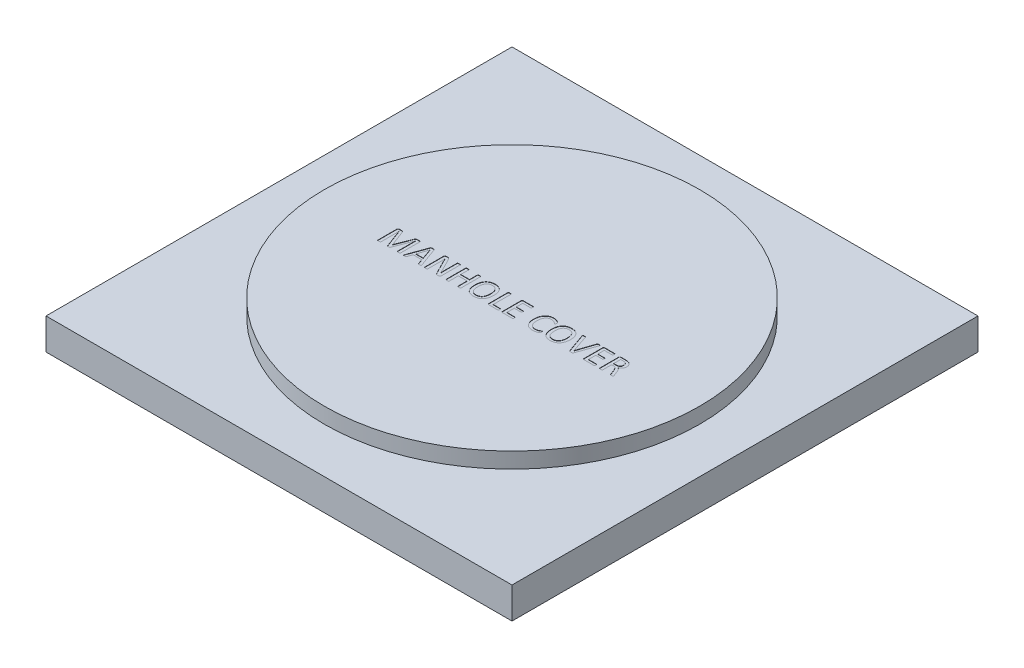
from build123d import *

# Parameters (mm, degrees)
SKETCH1_W           = 1490
SKETCH1_H           = 1490
BOSS_EXTRUDE1_DEPTH = 100
SKETCH2_R           = 600
BOSS_EXTRUDE2_DEPTH = 50
CUT_EXTRUDE1_DEPTH  = 1


with BuildPart() as part:
    # Sketch1 → Boss-Extrude1 (new body)
    with BuildSketch(Plane(origin=(0, 0, 0), x_dir=(1, 0, 0), z_dir=(0, 1, 0))):
        Rectangle(SKETCH1_W, SKETCH1_H)
    extrude(amount=BOSS_EXTRUDE1_DEPTH)

    # Sketch2 → Boss-Extrude2 (add)
    with BuildSketch(Plane(origin=(0, 100, 0), x_dir=(1, 0, 0), z_dir=(0, 1, 0))):
        with Locations(Location((0, 0, 0), (0, 0, 270))):
            Circle(SKETCH2_R)
    extrude(amount=BOSS_EXTRUDE2_DEPTH)

    # Sketch3 → Cut-Extrude1 (cut)
    # profile 1 of 12: a face of its own
    with BuildSketch(Plane(origin=(0, 150, 0), x_dir=(1, 0, 0), z_dir=(0, 1, 0))):
        with BuildLine():
            add(Edge.make_bspline(
                [(-302.519914216, -54.441295243), (-302.531290085, -54.570175678), (-302.553925876, -54.826622955), (-302.752547962, -55.182973018), (-303.101917063, -55.469457519), (-303.608901488, -55.674527482), (-304.280922797, -55.804356236), (-305.117146008, -55.974469731), (-306.186633031, -56.053795424), (-306.973189711, -56.062631324), (-307.413976333, -56.067582965)],
                knots=[0, 0, 0, 0, 0.549940415, 1.094275647, 1.695058239, 2.453752044, 3.41269449, 4.626954335, 6.109744105, 8, 8, 8, 8], degree=3))
            add(Edge.make_bspline(
                [(-307.413976333, -56.067582965), (-307.82938277, -56.061677257), (-308.600598927, -56.050713109), (-309.660357327, -55.975619013), (-310.511070149, -55.804582068), (-311.18609928, -55.678753901), (-311.681790371, -55.464299218), (-312.03309373, -55.18741814), (-312.209603042, -54.822164496), (-312.234575833, -54.569468748), (-312.247242647, -54.441295243)],
                knots=[0, 0, 0, 0, 1.798275377, 3.338559297, 4.58570577, 5.553580443, 6.299307474, 6.905686155, 7.444937074, 8, 8, 8, 8], degree=3))
            Line((-312.247242647, -54.441295243), (-312.247242647, 2.90434565))
            Line((-312.247242647, 2.90434565), (-312.353635302, 2.90434565))
            Line((-312.353635302, 2.90434565), (-334.513705384, -54.699677404))
            add(Edge.make_bspline(
                [(-334.513705384, -54.699677404), (-334.570010284, -54.809055366), (-334.685665759, -55.033727823), (-334.95261814, -55.322939973), (-335.310590085, -55.588288889), (-335.794562027, -55.767429388), (-336.388510164, -55.899365395), (-337.084178343, -56.005373448), (-337.90712003, -56.064326931), (-338.495729198, -56.066437908), (-338.815008425, -56.067582965)],
                knots=[0, 0, 0, 0, 0.617868315, 1.269158706, 1.964077171, 2.846421734, 3.844013633, 5.032644331, 6.390417486, 8, 8, 8, 8], degree=3))
            add(Edge.make_bspline(
                [(-338.815008425, -56.067582965), (-339.149372854, -56.059351628), (-339.768032747, -56.044121544), (-340.628292744, -55.995801121), (-341.345536508, -55.874713386), (-341.929468665, -55.714537904), (-342.385176661, -55.507444217), (-342.751223452, -55.293607048), (-342.986040276, -55.003149672), (-343.084452176, -54.797847867), (-343.131510417, -54.699677404)],
                knots=[0, 0, 0, 0, 1.684713544, 3.117151853, 4.33356902, 5.342914851, 6.153770431, 6.85436779, 7.4521858, 8, 8, 8, 8], degree=3))
            Line((-343.131510417, -54.699677404), (-364.714020374, 2.90434565))
            Line((-364.714020374, 2.90434565), (-364.774816176, 2.90434565))
            Line((-364.774816176, 2.90434565), (-364.774816176, -54.441295243))
            add(Edge.make_bspline(
                [(-364.774816176, -54.441295243), (-364.786192485, -54.570173794), (-364.808829151, -54.82661732), (-365.007444506, -55.18299625), (-365.356844254, -55.469349312), (-365.868295607, -55.676987664), (-366.551342097, -55.803276984), (-367.407448378, -55.975732586), (-368.492319185, -56.052510455), (-369.288916203, -56.06221399), (-369.729674096, -56.067582965)],
                knots=[0, 0, 0, 0, 0.544103173, 1.082660658, 1.677066352, 2.427707141, 3.397415481, 4.619936966, 6.129807882, 8, 8, 8, 8], degree=3))
            add(Edge.make_bspline(
                [(-369.729674096, -56.067582965), (-370.155191141, -56.061933514), (-370.931459632, -56.051627249), (-371.991557922, -55.976477629), (-372.831273372, -55.802178259), (-373.498008987, -55.681828117), (-373.983702339, -55.464501443), (-374.320787516, -55.185886403), (-374.479788284, -54.819642187), (-374.494591179, -54.569125602), (-374.502144608, -54.441295243)],
                knots=[0, 0, 0, 0, 1.8533371, 3.381033053, 4.614072809, 5.587846392, 6.318072483, 6.911573342, 7.444611737, 8, 8, 8, 8], degree=3))
            Line((-374.502144608, -54.441295243), (-374.502144608, 6.111324242))
            add(Edge.make_bspline(
                [(-374.502144608, 6.111324242), (-374.490370759, 6.442507557), (-374.468300977, 7.063302278), (-374.234465266, 7.915204379), (-373.87427258, 8.639866381), (-373.315754782, 9.168417274), (-372.697063771, 9.573095222), (-372.030826344, 9.872197012), (-371.328595393, 10.038492342), (-370.850126157, 10.065009579), (-370.611213235, 10.078250368)],
                knots=[0, 0, 0, 0, 1.261982118, 2.365553467, 3.35280749, 4.310975745, 5.26129003, 6.171318277, 7.086888644, 8, 8, 8, 8], degree=3))
            Line((-370.611213235, 10.078250368), (-364.896407782, 10.078250368))
            add(Edge.make_bspline(
                [(-364.896407782, 10.078250368), (-364.343148001, 10.066314818), (-363.312242519, 10.044074951), (-361.860446848, 9.813855927), (-360.592440866, 9.432504893), (-359.507154999, 8.835914721), (-358.567324094, 8.091237425), (-357.83396325, 7.117996084), (-357.203940992, 5.996160101), (-356.885844082, 5.163815924), (-356.719372319, 4.728219731)],
                knots=[0, 0, 0, 0, 1.24751318, 2.324528587, 3.308036964, 4.218670816, 5.104345063, 5.991788597, 6.949029422, 8, 8, 8, 8], degree=3))
            Line((-356.719372319, 4.728219731), (-338.511029412, -42.935689583))
            Line((-338.511029412, -42.935689583), (-338.25264725, -42.935689583))
            Line((-338.25264725, -42.935689583), (-319.740325329, 4.576230224))
            add(Edge.make_bspline(
                [(-319.740325329, 4.576230224), (-319.536918086, 5.051848067), (-319.154011803, 5.947180296), (-318.470892433, 7.147540737), (-317.722847116, 8.130395793), (-316.888582294, 8.892746582), (-315.966974578, 9.461820268), (-314.934674224, 9.823531463), (-313.781234653, 10.038709835), (-312.967713064, 10.064542447), (-312.53602271, 10.078250368)],
                knots=[0, 0, 0, 0, 1.266394147, 2.383938095, 3.374429421, 4.279357972, 5.137103734, 6.00865411, 6.943304242, 8, 8, 8, 8], degree=3))
            Line((-312.53602271, 10.078250368), (-306.532437194, 10.078250368))
            add(Edge.make_bspline(
                [(-306.532437194, 10.078250368), (-306.26303506, 10.065681581), (-305.734140126, 10.041006319), (-304.972721561, 9.874129332), (-304.274025449, 9.593996914), (-303.687076415, 9.149059005), (-303.18176848, 8.596483642), (-302.82935213, 7.890022183), (-302.539185894, 7.06018296), (-302.52666725, 6.443816076), (-302.519914216, 6.111324242)],
                knots=[0, 0, 0, 0, 1.011400516, 1.985599013, 2.915098522, 3.813295393, 4.72984914, 5.700323623, 6.759466748, 8, 8, 8, 8], degree=3))
            Line((-302.519914216, 6.111324242), (-302.519914216, -54.441295243))
        make_face()
    # profile 2 of 12: a face of its own
    with BuildSketch(Plane(origin=(0, 150, 0), x_dir=(1, 0, 0), z_dir=(0, 1, 0))):
        with BuildLine():
            add(Edge.make_bspline(
                [(-235.234159582, -52.678216965), (-235.114546234, -53.00942024), (-234.904318345, -53.591530569), (-234.787561756, -54.405559295), (-234.823831626, -55.070442899), (-235.177273723, -55.581309408), (-235.799786485, -55.862036599), (-236.639825863, -56.008330285), (-237.762269025, -56.042320622), (-238.603439984, -56.058452982), (-239.079494102, -56.067582965)],
                knots=[0, 0, 0, 0, 1.20658454, 2.120647273, 2.822909938, 3.436613703, 4.145757244, 5.10581043, 6.362056075, 8, 8, 8, 8], degree=3))
            add(Edge.make_bspline(
                [(-239.079494102, -56.067582965), (-239.555662748, -56.065962117), (-240.407213556, -56.063063491), (-241.535408608, -56.015461289), (-242.386465538, -55.901126555), (-243.021371147, -55.787659104), (-243.479417558, -55.569993945), (-243.794276939, -55.267533), (-244.016750355, -54.901943436), (-244.147845347, -54.639835889), (-244.21673943, -54.502091046)],
                knots=[0, 0, 0, 0, 1.98472369, 3.549358147, 4.698993141, 5.564621514, 6.225559426, 6.778136562, 7.357876606, 8, 8, 8, 8], degree=3))
            Line((-244.21673943, -54.502091046), (-249.901146982, -38.558391789))
            Line((-249.901146982, -38.558391789), (-277.502441406, -38.558391789))
            Line((-277.502441406, -38.558391789), (-282.943665748, -54.289305736))
            add(Edge.make_bspline(
                [(-282.943665748, -54.289305736), (-283.000524318, -54.432783242), (-283.110207731, -54.7095595), (-283.33966437, -55.095901466), (-283.679475407, -55.407442595), (-284.127398416, -55.681581799), (-284.746488752, -55.868178427), (-285.557114283, -56.00433654), (-286.601400762, -56.042877362), (-287.376819493, -56.058763193), (-287.807329963, -56.067582965)],
                knots=[0, 0, 0, 0, 0.663060064, 1.27908053, 1.910294906, 2.623277198, 3.518069493, 4.666729453, 6.149376829, 8, 8, 8, 8], degree=3))
            add(Edge.make_bspline(
                [(-287.807329963, -56.067582965), (-288.257831694, -56.061006018), (-289.073955223, -56.049091299), (-290.171514792, -55.986291324), (-290.990365601, -55.795469069), (-291.610019757, -55.525347452), (-291.915298262, -55.003317275), (-291.969947284, -54.355859202), (-291.821857438, -53.546832852), (-291.617061326, -52.963901847), (-291.500674977, -52.632620113)],
                knots=[0, 0, 0, 0, 1.579143439, 2.860757301, 3.828777215, 4.535214375, 5.14067361, 5.838145468, 6.771410487, 8, 8, 8, 8], degree=3))
            Line((-291.500674977, -52.632620113), (-269.24941119, 8.31517209))
            add(Edge.make_bspline(
                [(-269.24941119, 8.31517209), (-269.174339991, 8.480420576), (-269.030439308, 8.797178133), (-268.717658262, 9.217785024), (-268.275035701, 9.53874234), (-267.68813035, 9.757725396), (-266.946587282, 9.920532412), (-266.014242928, 10.017043676), (-264.86279783, 10.075821115), (-264.016012193, 10.077387808), (-263.549804687, 10.078250368)],
                knots=[0, 0, 0, 0, 0.683309499, 1.30980594, 1.951546434, 2.714075901, 3.654596571, 4.80831387, 6.242780742, 8, 8, 8, 8], degree=3))
            add(Edge.make_bspline(
                [(-263.549804687, 10.078250368), (-263.048155631, 10.077443815), (-262.140647904, 10.075984721), (-260.908041381, 10.017145316), (-259.920642167, 9.920985843), (-259.135074204, 9.761478978), (-258.521577156, 9.522026855), (-258.049490683, 9.192216598), (-257.718307815, 8.755011933), (-257.574849864, 8.425085661), (-257.500622319, 8.254376287)],
                knots=[0, 0, 0, 0, 1.785799845, 3.230599435, 4.391881448, 5.315322, 6.075681796, 6.721513625, 7.338489756, 8, 8, 8, 8], degree=3))
            Line((-257.500622319, 8.254376287), (-235.234159582, -52.678216965))
        make_face()
        Polygon((-263.808186849, 1.32365478), (-263.853783701, 1.32365478), (-275.298593559, -31.749261887), (-252.211387485, -31.749261887), align=None, mode=Mode.SUBTRACT)
    # profile 3 of 12: a face of its own
    with BuildSketch(Plane(origin=(0, 150, 0), x_dir=(1, 0, 0), z_dir=(0, 1, 0))):
        with BuildLine():
            add(Edge.make_bspline(
                [(-174.119178922, -52.298243198), (-174.133350402, -52.61494864), (-174.160041103, -53.211434682), (-174.44660887, -54.029140072), (-174.879315614, -54.692994504), (-175.425009605, -55.220110767), (-176.061113313, -55.624545756), (-176.767715224, -55.885327821), (-177.501511147, -56.043391215), (-177.994150894, -56.059571077), (-178.238094554, -56.067582965)],
                knots=[0, 0, 0, 0, 1.205332051, 2.270133854, 3.263058457, 4.207272684, 5.146716114, 6.120602819, 7.069366549, 8, 8, 8, 8], degree=3))
            Line((-178.238094554, -56.067582965), (-181.338680492, -56.067582965))
            add(Edge.make_bspline(
                [(-181.338680492, -56.067582965), (-181.800260194, -56.052567936), (-182.668182626, -56.024334717), (-183.90778038, -55.826405551), (-185.021922854, -55.392742899), (-186.064421208, -54.734487549), (-187.059793892, -53.805438713), (-188.057489542, -52.614035036), (-189.045813721, -51.10715424), (-189.638256014, -49.963798583), (-189.956485524, -49.349646767)],
                knots=[0, 0, 0, 0, 0.949232932, 1.784871716, 2.566305995, 3.389914927, 4.304220435, 5.353751779, 6.578571646, 8, 8, 8, 8], degree=3))
            Line((-189.956485524, -49.349646767), (-209.107163373, -11.899432306))
            add(Edge.make_bspline(
                [(-209.107163373, -11.899432306), (-209.609432432, -10.906806988), (-210.632383373, -8.885167422), (-212.161979866, -5.829156749), (-213.599103655, -2.724811533), (-214.520506143, -0.653325093), (-214.973958333, 0.366120887)],
                knots=[0, 0, 0, 0, 0.981689664, 1.999367364, 3.015423486, 4, 4, 4, 4], degree=3))
            Line((-214.973958333, 0.366120887), (-215.080350988, 0.366120887))
            add(Edge.make_bspline(
                [(-215.080350988, 0.366120887), (-215.051627582, -0.864938429), (-214.993476831, -3.357227321), (-214.968676215, -7.11680274), (-214.97527488, -10.906430639), (-214.974396595, -13.43452514), (-214.973958333, -14.69603923)],
                knots=[0, 0, 0, 0, 0.98097619, 1.98599371, 2.995014897, 4, 4, 4, 4], degree=3))
            Line((-214.973958333, -14.69603923), (-214.973958333, -54.441295243))
            add(Edge.make_bspline(
                [(-214.973958333, -54.441295243), (-214.986582768, -54.559877703), (-215.012758895, -54.80575243), (-215.210453655, -55.153421536), (-215.552832225, -55.454376668), (-216.059444119, -55.678621673), (-216.735514396, -55.802625984), (-217.575927244, -55.976310003), (-218.645898934, -56.052417544), (-219.432347558, -56.062176659), (-219.86802045, -56.067582965)],
                knots=[0, 0, 0, 0, 0.508335614, 1.054008165, 1.670659208, 2.440203295, 3.401501664, 4.618744696, 6.126869023, 8, 8, 8, 8], degree=3))
            add(Edge.make_bspline(
                [(-219.86802045, -56.067582965), (-220.303645811, -56.062134066), (-221.090008632, -56.052298065), (-222.160495561, -55.976652221), (-222.994666768, -55.80270343), (-223.660508296, -55.684376806), (-224.141534574, -55.444680856), (-224.48365479, -55.158302126), (-224.659212251, -54.801423966), (-224.687508146, -54.559230687), (-224.701286765, -54.441295243)],
                knots=[0, 0, 0, 0, 1.889779863, 3.4113088, 4.639371011, 5.587829463, 6.32466679, 6.946798791, 7.487146164, 8, 8, 8, 8], degree=3))
            Line((-224.701286765, -54.441295243), (-224.701286765, 6.308910601))
            add(Edge.make_bspline(
                [(-224.701286765, 6.308910601), (-224.690611256, 6.625242503), (-224.67043398, 7.223126566), (-224.41819948, 8.040104541), (-224.040354167, 8.734948816), (-223.466900496, 9.232023458), (-222.830072501, 9.60280825), (-222.161597928, 9.884124681), (-221.45549427, 10.03768702), (-220.978229757, 10.064532872), (-220.734360639, 10.078250368)],
                knots=[0, 0, 0, 0, 1.223169262, 2.311854749, 3.289963268, 4.250317348, 5.211476418, 6.146325302, 7.052822907, 8, 8, 8, 8], degree=3))
            Line((-220.734360639, 10.078250368), (-216.098680683, 10.078250368))
            add(Edge.make_bspline(
                [(-216.098680683, 10.078250368), (-215.596138746, 10.070994775), (-214.677503775, 10.057731719), (-213.405243496, 9.856601315), (-212.309953249, 9.528839411), (-211.355908165, 8.982647333), (-210.464579288, 8.262748166), (-209.628486566, 7.309541942), (-208.796003982, 6.128520056), (-208.325471973, 5.216401882), (-208.073634727, 4.728219731)],
                knots=[0, 0, 0, 0, 1.163767092, 2.127339175, 2.97798627, 3.798249142, 4.658572155, 5.623288963, 6.727941249, 8, 8, 8, 8], degree=3))
            Line((-208.073634727, 4.728219731), (-193.376249426, -24.1649855))
            add(Edge.make_bspline(
                [(-193.376249426, -24.1649855), (-192.928132639, -25.035241324), (-192.044365429, -26.751542932), (-190.772729052, -29.317696933), (-189.515810278, -31.815392492), (-188.342576905, -34.291030347), (-187.158999698, -36.703882799), (-186.029668863, -39.107609769), (-184.854928356, -41.472047032), (-184.111745982, -43.065842066), (-183.740114698, -43.862825574)],
                knots=[0, 0, 0, 0, 1.0712473, 2.112693089, 3.134304823, 4.131228243, 5.110761677, 6.075495007, 7.037643669, 8, 8, 8, 8], degree=3))
            Line((-183.740114698, -43.862825574), (-183.694517846, -43.862825574))
            add(Edge.make_bspline(
                [(-183.694517846, -43.862825574), (-183.72198288, -42.500022757), (-183.778032755, -39.718852703), (-183.822416656, -35.518700547), (-183.829448188, -31.318617329), (-183.840897431, -28.537214719), (-183.846507353, -27.174377734)],
                knots=[0, 0, 0, 0, 0.980073767, 2.000107263, 3.020088721, 4, 4, 4, 4], degree=3))
            Line((-183.846507353, -27.174377734), (-183.846507353, 8.451962646))
            add(Edge.make_bspline(
                [(-183.846507353, 8.451962646), (-183.833528863, 8.570304601), (-183.80737102, 8.808820039), (-183.623222378, 9.155429995), (-183.278892195, 9.449483729), (-182.770324449, 9.685849713), (-182.100103799, 9.880506387), (-181.235044954, 9.987590887), (-180.149533442, 10.063667424), (-179.342775287, 10.07302036), (-178.891649433, 10.078250368)],
                knots=[0, 0, 0, 0, 0.502306873, 1.012387733, 1.62172544, 2.391521802, 3.378703101, 4.574561681, 6.084551388, 8, 8, 8, 8], degree=3))
            add(Edge.make_bspline(
                [(-178.891649433, 10.078250368), (-178.485978102, 10.072794397), (-177.729607388, 10.062621785), (-176.691737184, 9.981328302), (-175.829201549, 9.894110938), (-175.179336929, 9.663937949), (-174.681666728, 9.437480868), (-174.360850627, 9.130423427), (-174.157498638, 8.802882541), (-174.131613664, 8.565836105), (-174.119178922, 8.451962646)],
                knots=[0, 0, 0, 0, 1.782961236, 3.324315921, 4.584666104, 5.571046144, 6.348297572, 6.962920232, 7.501802847, 8, 8, 8, 8], degree=3))
            Line((-174.119178922, 8.451962646), (-174.119178922, -52.298243198))
        make_face()
    # profile 4 of 12: a face of its own
    with BuildSketch(Plane(origin=(0, 150, 0), x_dir=(1, 0, 0), z_dir=(0, 1, 0))):
        with BuildLine():
            add(Edge.make_bspline(
                [(-108.946078431, -54.441295243), (-108.958735485, -54.569491111), (-108.983689034, -54.822230947), (-109.160345317, -55.187147855), (-109.514690301, -55.468518514), (-110.019206508, -55.674759761), (-110.696923297, -55.805871712), (-111.53847528, -55.972764642), (-112.592501929, -56.052736378), (-113.358809779, -56.062322362), (-113.779344746, -56.067582965)],
                knots=[0, 0, 0, 0, 0.555183087, 1.094550744, 1.701060695, 2.466987252, 3.435071453, 4.68248791, 6.179413357, 8, 8, 8, 8], degree=3))
            add(Edge.make_bspline(
                [(-113.779344746, -56.067582965), (-114.225164807, -56.062473541), (-115.021776852, -56.053343784), (-116.096744306, -55.976111537), (-116.938800516, -55.805130781), (-117.605880421, -55.663074508), (-118.108091089, -55.449646872), (-118.459228899, -55.172102876), (-118.635774399, -54.806994142), (-118.660742452, -54.554279421), (-118.673406863, -54.426096292)],
                knots=[0, 0, 0, 0, 1.907610173, 3.408606684, 4.598780777, 5.581686739, 6.318846301, 6.91825845, 7.451314051, 8, 8, 8, 8], degree=3))
            Line((-118.673406863, -54.426096292), (-118.673406863, -24.940131985))
            Line((-118.673406863, -24.940131985), (-146.882659314, -24.940131985))
            Line((-146.882659314, -24.940131985), (-146.882659314, -54.426096292))
            add(Edge.make_bspline(
                [(-146.882659314, -54.426096292), (-146.895168347, -54.554476204), (-146.91983007, -54.807578886), (-147.096982544, -55.166216678), (-147.436019513, -55.459472641), (-147.944004465, -55.654488079), (-148.614903938, -55.813221924), (-149.465605501, -55.971199822), (-150.533940003, -56.053679611), (-151.315575841, -56.062643243), (-151.746323529, -56.067582965)],
                knots=[0, 0, 0, 0, 0.551432386, 1.087156187, 1.673203308, 2.433955425, 3.400665773, 4.639654944, 6.148164666, 8, 8, 8, 8], degree=3))
            add(Edge.make_bspline(
                [(-151.746323529, -56.067582965), (-152.166780016, -56.061714444), (-152.943035314, -56.05087986), (-154.008046362, -55.976239219), (-154.863066193, -55.801913674), (-155.544417394, -55.681383732), (-156.044509589, -55.46417658), (-156.395844335, -55.187444237), (-156.572346786, -54.82215808), (-156.597320475, -54.569466589), (-156.609987745, -54.441295243)],
                knots=[0, 0, 0, 0, 1.810397557, 3.34239271, 4.582827882, 5.566745421, 6.308459453, 6.911575013, 7.447924048, 8, 8, 8, 8], degree=3))
            Line((-156.609987745, -54.441295243), (-156.609987745, 8.451962646))
            add(Edge.make_bspline(
                [(-156.609987745, 8.451962646), (-156.59735294, 8.580215873), (-156.572443257, 8.833068794), (-156.395451943, 9.197121989), (-156.04796912, 9.478188036), (-155.537503123, 9.666665763), (-154.86855195, 9.82652069), (-154.004169484, 9.957243306), (-152.944809784, 10.071304101), (-152.167238776, 10.075810799), (-151.746323529, 10.078250368)],
                knots=[0, 0, 0, 0, 0.552440226, 1.089143157, 1.692656667, 2.42614887, 3.415780176, 4.653384476, 6.188407898, 8, 8, 8, 8], degree=3))
            add(Edge.make_bspline(
                [(-151.746323529, 10.078250368), (-151.315385628, 10.074248841), (-150.533404628, 10.066987658), (-149.468013957, 9.974226619), (-148.612276584, 9.845399442), (-147.948933113, 9.673748508), (-147.432228992, 9.503314497), (-147.102702398, 9.208596379), (-146.91918187, 8.86534898), (-146.894938557, 8.621213948), (-146.882659314, 8.497559498)],
                knots=[0, 0, 0, 0, 1.864183799, 3.38275261, 4.626336672, 5.599493267, 6.356796548, 6.946751567, 7.466529424, 8, 8, 8, 8], degree=3))
            Line((-146.882659314, 8.497559498), (-146.882659314, -17.15826924))
            Line((-146.882659314, -17.15826924), (-118.673406863, -17.15826924))
            Line((-118.673406863, -17.15826924), (-118.673406863, 8.497559498))
            add(Edge.make_bspline(
                [(-118.673406863, 8.497559498), (-118.660980968, 8.621029347), (-118.636448118, 8.864799915), (-118.453333735, 9.214315993), (-118.112058654, 9.493649119), (-117.60069584, 9.68207666), (-116.941543721, 9.8375112), (-116.094214723, 9.97894105), (-115.02237342, 10.066864551), (-114.225378872, 10.074164812), (-113.779344746, 10.078250368)],
                knots=[0, 0, 0, 0, 0.530819962, 1.04801524, 1.651431642, 2.38480582, 3.374277889, 4.568622803, 6.079646421, 8, 8, 8, 8], degree=3))
            add(Edge.make_bspline(
                [(-113.779344746, 10.078250368), (-113.358335961, 10.076507467), (-112.590682201, 10.073329517), (-111.542329707, 9.953929653), (-110.691423886, 9.830432766), (-110.02597413, 9.660070384), (-109.511333353, 9.482545451), (-109.160720736, 9.196840654), (-108.983596735, 8.833137961), (-108.958704424, 8.58023915), (-108.946078431, 8.451962646)],
                knots=[0, 0, 0, 0, 1.82170296, 3.321634079, 4.566145697, 5.540028143, 6.297896277, 6.904778117, 7.444476495, 8, 8, 8, 8], degree=3))
            Line((-108.946078431, 8.451962646), (-108.946078431, -54.441295243))
        make_face()
    # profile 5 of 12: a face of its own
    with BuildSketch(Plane(origin=(0, 150, 0), x_dir=(1, 0, 0), z_dir=(0, 1, 0))):
        with BuildLine():
            add(Edge.make_bspline(
                [(-35.991115196, -22.234718765), (-36.014937124, -23.537523392), (-36.061557479, -26.08715812), (-36.411241757, -29.810975375), (-37.000617486, -33.342971719), (-37.832878477, -36.667513077), (-38.887368476, -39.782472557), (-40.198316315, -42.653830715), (-41.742569837, -45.285995677), (-43.504055402, -47.690679782), (-45.526343382, -49.833293101), (-47.785847245, -51.713630787), (-50.29687655, -53.320927681), (-53.035256911, -54.676418864), (-56.018322141, -55.743309822), (-59.234983263, -56.497087552), (-62.6872531, -56.960073889), (-65.070269407, -57.013034451), (-66.29782284, -57.040315808)],
                knots=[0, 0, 0, 0, 1.19137641, 2.331565767, 3.417042525, 4.463281839, 5.462606823, 6.420512668, 7.344711138, 8.249186097, 9.140739235, 10.032400728, 10.93079057, 11.861193805, 12.821170558, 13.821397441, 14.877745384, 16, 16, 16, 16], degree=3))
            add(Edge.make_bspline(
                [(-66.29782284, -57.040315808), (-67.505106097, -57.017749879), (-69.846621749, -56.97398345), (-73.227407181, -56.53234205), (-76.365748344, -55.868859256), (-79.246769254, -54.890205134), (-81.874572687, -53.637860706), (-84.27217969, -52.139685695), (-86.42701678, -50.38302797), (-88.344518611, -48.369979864), (-90.028974322, -46.106578979), (-91.451316798, -43.573668821), (-92.67586379, -40.807526995), (-93.657483645, -37.780989543), (-94.412163877, -34.510076175), (-94.927388648, -30.997119237), (-95.276730539, -27.257402406), (-95.310476824, -24.682600379), (-95.327818627, -23.359441115)],
                knots=[0, 0, 0, 0, 1.137445095, 2.206065128, 3.208407631, 4.156851521, 5.066857725, 5.946688419, 6.815641936, 7.680385637, 8.56104548, 9.467951058, 10.41303433, 11.408286435, 12.462476973, 13.573548823, 14.753076423, 16, 16, 16, 16], degree=3))
            add(Edge.make_bspline(
                [(-95.327818627, -23.359441115), (-95.304396805, -22.081903372), (-95.258670041, -19.587747954), (-94.90389204, -15.935409156), (-94.319716528, -12.463181791), (-93.480111881, -9.176440188), (-92.436384118, -6.087782571), (-91.114622134, -3.242001933), (-89.582884913, -0.623491413), (-87.793105065, 1.748989096), (-85.763299959, 3.871319657), (-83.496116599, 5.743457583), (-80.985953151, 7.341570614), (-78.246118227, 8.687618285), (-75.26598381, 9.756973789), (-72.038008307, 10.507145631), (-68.575909951, 10.970181101), (-66.187868851, 11.023549571), (-64.960315181, 11.050983211)],
                knots=[0, 0, 0, 0, 1.175256309, 2.294469895, 3.372697637, 4.411680733, 5.412616409, 6.367821432, 7.293569431, 8.198811264, 9.095564309, 9.989623777, 10.897346502, 11.827111084, 12.792869429, 13.803655498, 14.870986452, 16, 16, 16, 16], degree=3))
            add(Edge.make_bspline(
                [(-64.960315181, 11.050983211), (-63.778699612, 11.025877705), (-61.483921209, 10.977121092), (-58.158486455, 10.568127878), (-55.073860674, 9.870102809), (-52.220987185, 8.908083357), (-49.592549187, 7.698318452), (-47.198815963, 6.205494596), (-45.024550372, 4.471191166), (-43.098946839, 2.459383933), (-41.407073231, 0.203324342), (-39.914097609, -2.282048515), (-38.714391355, -5.04588501), (-37.7048481, -8.033950709), (-36.942910806, -11.267412912), (-36.383453816, -14.720526026), (-36.044082351, -18.402850963), (-36.009123314, -20.931935411), (-35.991115196, -22.234718765)],
                knots=[0, 0, 0, 0, 1.124252185, 2.183374782, 3.182256192, 4.129105229, 5.043721226, 5.929425601, 6.80741917, 7.683782861, 8.571911764, 9.486451506, 10.436181025, 11.433338738, 12.484662547, 13.593591443, 14.760409517, 16, 16, 16, 16], degree=3))
        make_face()
        with BuildLine():
            add(Edge.make_bspline(
                [(-45.718443627, -22.888273644), (-45.730300336, -21.976090311), (-45.75364292, -20.18025343), (-45.932268353, -17.535882406), (-46.260747239, -14.991639946), (-46.674042707, -12.552636099), (-47.220793004, -10.231181034), (-47.975804162, -8.069980282), (-48.863407931, -6.051467283), (-49.935208242, -4.202958042), (-51.162253928, -2.511363894), (-52.606296379, -1.02402633), (-54.246420008, 0.257081721), (-56.074384804, 1.350429748), (-58.115835517, 2.224052866), (-60.380516117, 2.840628973), (-62.871195962, 3.206708826), (-64.60436846, 3.247740158), (-65.507477405, 3.269120466)],
                knots=[0, 0, 0, 0, 1.169250427, 2.301930944, 3.395008842, 4.456274514, 5.472222399, 6.447763327, 7.38673591, 8.294558986, 9.18170536, 10.058907655, 10.942338117, 11.842252221, 12.781965628, 13.779311434, 14.842859721, 16, 16, 16, 16], degree=3))
            add(Edge.make_bspline(
                [(-65.507477405, 3.269120466), (-66.410878253, 3.244103084), (-68.145934846, 3.196055117), (-70.642802012, 2.795107922), (-72.916627732, 2.138383658), (-74.966468293, 1.195299412), (-76.792069787, 0.031319008), (-78.444057692, -1.31060736), (-79.920267402, -2.825960515), (-81.197764437, -4.53251796), (-82.316504154, -6.384175319), (-83.257032386, -8.391973714), (-84.012147883, -10.554939163), (-84.620555423, -12.84119921), (-85.043530579, -15.239062926), (-85.36344345, -17.703769323), (-85.570355161, -20.229995971), (-85.590375016, -21.935407958), (-85.600490196, -22.79707994)],
                knots=[0, 0, 0, 0, 1.161109193, 2.230006939, 3.242146217, 4.195396554, 5.120768157, 6.019191557, 6.926803525, 7.833666984, 8.754302376, 9.704386277, 10.67901314, 11.696672534, 12.743199842, 13.807421854, 14.892183724, 16, 16, 16, 16], degree=3))
            add(Edge.make_bspline(
                [(-85.600490196, -22.79707994), (-85.589682863, -23.739765242), (-85.568453988, -25.591484582), (-85.376207196, -28.309033041), (-85.098987206, -30.918680911), (-84.677281464, -33.402039874), (-84.119151057, -35.751051623), (-83.416186244, -37.94498191), (-82.524407091, -39.968863928), (-81.481823721, -41.833652004), (-80.251121687, -43.517478868), (-78.815339869, -44.996084072), (-77.194454883, -46.275869486), (-75.381609033, -47.375920813), (-73.333841949, -48.230628342), (-71.052724884, -48.82752247), (-68.533963349, -49.197600989), (-66.775427751, -49.237576384), (-65.857053271, -49.258453063)],
                knots=[0, 0, 0, 0, 1.196993268, 2.351257178, 3.458234918, 4.528672635, 5.547698982, 6.522289971, 7.449941179, 8.351729023, 9.230641879, 10.090605086, 10.960784804, 11.846827774, 12.775304165, 13.767908032, 14.834316289, 16, 16, 16, 16], degree=3))
            add(Edge.make_bspline(
                [(-65.857053271, -49.258453063), (-64.948647728, -49.233056254), (-63.198628825, -49.184129983), (-60.681128032, -48.786323511), (-58.387405453, -48.127734668), (-56.32304681, -47.184119717), (-54.471215678, -46.017803723), (-52.810893655, -44.660989562), (-51.330110343, -43.124332232), (-50.053027353, -41.397003421), (-48.964736648, -39.495541638), (-48.014760686, -37.467829556), (-47.276697328, -35.281197701), (-46.686642248, -32.978698346), (-46.259181438, -30.56307495), (-45.934629735, -28.06836907), (-45.753877602, -25.500136734), (-45.730337909, -23.765009474), (-45.718443627, -22.888273644)],
                knots=[0, 0, 0, 0, 1.156546549, 2.228055893, 3.236790421, 4.186873135, 5.108930184, 6.01699397, 6.911520701, 7.820111692, 8.745392135, 9.698166525, 10.66751403, 11.680142067, 12.723095794, 13.790029056, 14.883332216, 16, 16, 16, 16], degree=3))
        make_face(mode=Mode.SUBTRACT)
    # profile 6 of 12: a face of its own
    with BuildSketch(Plane(origin=(0, 150, 0), x_dir=(1, 0, 0), z_dir=(0, 1, 0))):
        with BuildLine():
            add(Edge.make_bspline(
                [(12.645526961, -52.146253691), (12.639648862, -52.465650438), (12.628806242, -53.054803194), (12.554120077, -53.86251272), (12.442153175, -54.540048131), (12.248298382, -55.092724087), (11.988952874, -55.526439656), (11.682518257, -55.856808736), (11.287841826, -56.032314632), (11.010629764, -56.055559975), (10.867249732, -56.067582965)],
                knots=[0, 0, 0, 0, 1.605872357, 2.962159556, 4.076477759, 5.051625799, 5.886174337, 6.606778445, 7.279395892, 8, 8, 8, 8], degree=3))
            Line((10.867249732, -56.067582965), (-18.147547105, -56.067582965))
            add(Edge.make_bspline(
                [(-18.147547105, -56.067582965), (-18.534133859, -56.026633607), (-19.332131555, -55.94210538), (-20.241481012, -55.428477007), (-20.863560494, -54.81765074), (-21.173769881, -54.163035353), (-21.378152994, -53.384862554), (-21.392438555, -52.816657606), (-21.400122549, -52.511028507)],
                knots=[0, 0, 0, 0, 1.275282567, 2.632455815, 3.355209583, 4.126983091, 4.992531704, 6, 6, 6, 6], degree=3))
            Line((-21.400122549, -52.511028507), (-21.400122549, 8.451962646))
            add(Edge.make_bspline(
                [(-21.400122549, 8.451962646), (-21.387487744, 8.580215873), (-21.362578061, 8.833068794), (-21.185586747, 9.197121989), (-20.838103924, 9.478188036), (-20.327637927, 9.666665763), (-19.658686754, 9.82652069), (-18.794304287, 9.957243306), (-17.734944588, 10.071304101), (-16.95737358, 10.075810799), (-16.536458333, 10.078250368)],
                knots=[0, 0, 0, 0, 0.552440226, 1.089143157, 1.692656667, 2.42614887, 3.415780176, 4.653384476, 6.188407898, 8, 8, 8, 8], degree=3))
            add(Edge.make_bspline(
                [(-16.536458333, 10.078250368), (-16.105303697, 10.076595095), (-15.322453824, 10.073589606), (-14.25898512, 9.954831276), (-13.402440626, 9.830953933), (-12.738808762, 9.65853772), (-12.223067186, 9.487792314), (-11.887453307, 9.191272029), (-11.709881268, 8.833647064), (-11.685275015, 8.580410478), (-11.672794118, 8.451962646)],
                knots=[0, 0, 0, 0, 1.854168173, 3.366623472, 4.60352618, 5.571454335, 6.324688884, 6.911474275, 7.44787295, 8, 8, 8, 8], degree=3))
            Line((-11.672794118, 8.451962646), (-11.672794118, -48.28572022))
            Line((-11.672794118, -48.28572022), (10.943244485, -48.28572022))
            add(Edge.make_bspline(
                [(10.943244485, -48.28572022), (11.083212545, -48.294942066), (11.351688741, -48.312630717), (11.701773568, -48.521990316), (12.007442513, -48.805868085), (12.244661553, -49.219605329), (12.451016281, -49.749015437), (12.550491055, -50.426076378), (12.629838548, -51.2373634), (12.640011765, -51.826737142), (12.645526961, -52.146253691)],
                knots=[0, 0, 0, 0, 0.712550928, 1.366761557, 2.050016936, 2.846993829, 3.797260971, 4.964749902, 6.354503146, 8, 8, 8, 8], degree=3))
        make_face()
    # profile 7 of 12: a face of its own
    with BuildSketch(Plane(origin=(0, 150, 0), x_dir=(1, 0, 0), z_dir=(0, 1, 0))):
        with BuildLine():
            add(Edge.make_bspline(
                [(59.336703431, -52.207049494), (59.330293071, -52.511304269), (59.31819824, -53.085360901), (59.245793475, -53.882918271), (59.127577248, -54.572717017), (58.886443647, -55.115043324), (58.641813612, -55.563162012), (58.314425847, -55.865517981), (57.936513498, -56.028004593), (57.676391431, -56.054181984), (57.543227252, -56.067582965)],
                knots=[0, 0, 0, 0, 1.551039663, 2.926444145, 4.08677933, 5.09439548, 5.940707236, 6.67238136, 7.320352757, 8, 8, 8, 8], degree=3))
            Line((57.543227252, -56.067582965), (25.655828738, -56.067582965))
            add(Edge.make_bspline(
                [(25.655828738, -56.067582965), (25.264214497, -56.027227789), (24.461165798, -55.944474997), (23.544571297, -55.42957985), (22.926988541, -54.813829241), (22.59508058, -54.167813585), (22.395086941, -53.379133977), (22.380669346, -52.80629373), (22.372855392, -52.495829557)],
                knots=[0, 0, 0, 0, 1.283024327, 2.630984544, 3.348831971, 4.123093912, 4.982766836, 6, 6, 6, 6], degree=3))
            Line((22.372855392, -52.495829557), (22.372855392, 6.50649696))
            add(Edge.make_bspline(
                [(22.372855392, 6.50649696), (22.378029919, 6.817868713), (22.387599547, 7.393711191), (22.618998595, 8.170590747), (22.922778916, 8.834130847), (23.567829423, 9.4354949), (24.490463291, 9.956768053), (25.304205128, 10.038401678), (25.70142559, 10.078250368)],
                knots=[0, 0, 0, 0, 1.010614797, 1.869003608, 2.630550752, 3.355321731, 4.709025054, 6, 6, 6, 6], degree=3))
            Line((25.70142559, 10.078250368), (57.573625153, 10.078250368))
            add(Edge.make_bspline(
                [(57.573625153, 10.078250368), (57.707746387, 10.066549115), (57.971854995, 10.043507261), (58.334209107, 9.855343526), (58.680005886, 9.58341676), (58.882552479, 9.119692283), (59.094579607, 8.573611305), (59.208504184, 7.876603396), (59.332160062, 7.047827433), (59.335102144, 6.4413899), (59.336703431, 6.111324242)],
                knots=[0, 0, 0, 0, 0.668354669, 1.316109436, 2.018833227, 2.825881518, 3.798343768, 4.964302348, 6.347761332, 8, 8, 8, 8], degree=3))
            add(Edge.make_bspline(
                [(59.336703431, 6.111324242), (59.334469526, 5.801671634), (59.330315162, 5.225814943), (59.210138229, 4.430893896), (59.086843187, 3.760730746), (58.909319795, 3.219862231), (58.67818894, 2.795172138), (58.376472229, 2.499670643), (58.008393134, 2.33363256), (57.752561117, 2.309148608), (57.619222005, 2.296387623)],
                knots=[0, 0, 0, 0, 1.608836867, 2.991931757, 4.175795774, 5.151123556, 5.94236908, 6.669547864, 7.306571131, 8, 8, 8, 8], degree=3))
            Line((57.619222005, 2.296387623), (32.100183824, 2.296387623))
            Line((32.100183824, 2.296387623), (32.100183824, -18.131002083))
            Line((32.100183824, -18.131002083), (53.743489583, -18.131002083))
            add(Edge.make_bspline(
                [(53.743489583, -18.131002083), (53.877787326, -18.141959167), (54.137657225, -18.163161432), (54.487718292, -18.35377337), (54.79793825, -18.610218131), (55.046998603, -18.985299757), (55.249351222, -19.46696637), (55.352094985, -20.088356041), (55.429050367, -20.82930508), (55.439932626, -21.368061389), (55.445772059, -21.657158639)],
                knots=[0, 0, 0, 0, 0.736172937, 1.424515283, 2.159090736, 2.943172998, 3.883905225, 5.025477629, 6.403867899, 8, 8, 8, 8], degree=3))
            add(Edge.make_bspline(
                [(55.445772059, -21.657158639), (55.440008277, -21.931068607), (55.429309071, -22.4395228), (55.351821409, -23.140103113), (55.247355148, -23.730887694), (55.046820651, -24.193008263), (54.800823665, -24.551685842), (54.488802444, -24.785608049), (54.127890418, -24.914756216), (53.876296805, -24.931364872), (53.743489583, -24.940131985)],
                knots=[0, 0, 0, 0, 1.579906653, 2.932752572, 4.068131091, 5.024067173, 5.819412736, 6.550349844, 7.234781805, 8, 8, 8, 8], degree=3))
            Line((53.743489583, -24.940131985), (32.100183824, -24.940131985))
            Line((32.100183824, -24.940131985), (32.100183824, -48.28572022))
            Line((32.100183824, -48.28572022), (57.604023055, -48.28572022))
            add(Edge.make_bspline(
                [(57.604023055, -48.28572022), (57.732966922, -48.297560247), (57.987181449, -48.320903017), (58.337409472, -48.508031781), (58.657300048, -48.79145251), (58.901382149, -49.215768077), (59.128391137, -49.74666659), (59.24729409, -50.429598741), (59.32010991, -51.26287259), (59.330821925, -51.872389813), (59.336703431, -52.207049494)],
                knots=[0, 0, 0, 0, 0.651958213, 1.285344175, 1.978227372, 2.799835326, 3.746680766, 4.903175595, 6.299666972, 8, 8, 8, 8], degree=3))
        make_face()
    # profile 8 of 12: a face of its own
    with BuildSketch(Plane(origin=(0, 150, 0), x_dir=(1, 0, 0), z_dir=(0, 1, 0))):
        with BuildLine():
            add(Edge.make_bspline(
                [(142.018995098, -47.419380032), (142.017454185, -47.68303687), (142.014577076, -48.175322479), (141.958781882, -48.863292374), (141.919024106, -49.468181177), (141.782394952, -49.980990675), (141.655909061, -50.443118268), (141.44681631, -50.85310912), (141.145811614, -51.268059473), (140.78518611, -51.625309603), (140.355823763, -51.95075057), (139.881930791, -52.267010803), (139.269599557, -52.648761105), (138.212098492, -53.263411504), (136.599302963, -54.062417257), (134.344190936, -54.969097001), (131.695080511, -55.777070113), (128.700979362, -56.478338795), (125.366367209, -56.969578754), (123.032310931, -57.016129253), (121.819589652, -57.040315808)],
                knots=[0, 0, 0, 0, 0.57946178, 1.081939299, 1.518734738, 1.90788836, 2.246191962, 2.570061064, 2.913282392, 3.37021711, 3.679981085, 4.097153101, 4.622693576, 5.266683985, 6.78637746, 8.575991717, 10.60581333, 12.870568803, 15.334867022, 18, 18, 18, 18], degree=3))
            add(Edge.make_bspline(
                [(121.819589652, -57.040315808), (120.759231944, -57.01567925), (118.680944201, -56.967391908), (115.644463785, -56.54036458), (112.757644899, -55.885645226), (110.040944686, -54.932020556), (107.487320508, -53.745803913), (105.150116436, -52.241370451), (102.974938213, -50.531307606), (101.019410352, -48.531709565), (99.268006328, -46.287942439), (97.724139201, -43.798101698), (96.42516818, -41.052760567), (95.305891763, -38.08443403), (94.446345363, -34.860743543), (93.833350791, -31.403371469), (93.442272356, -27.710226249), (93.402716217, -25.169142165), (93.382352941, -23.861006487)],
                knots=[0, 0, 0, 0, 1.027278517, 2.013452943, 2.9663862, 3.891989736, 4.799199612, 5.688801468, 6.579960621, 7.475856175, 8.392374808, 9.33401815, 10.309213362, 11.331691925, 12.404982327, 13.537738022, 14.732441495, 16, 16, 16, 16], degree=3))
            add(Edge.make_bspline(
                [(93.382352941, -23.861006487), (93.40642497, -22.517215837), (93.453235097, -19.904099514), (93.879158208, -16.099512664), (94.530662694, -12.516234533), (95.480299404, -9.162565982), (96.657443891, -6.040776156), (98.078224372, -3.167470713), (99.708315336, -0.53797067), (101.549526293, 1.848916489), (103.612759791, 3.96503523), (105.855480668, 5.838269267), (108.305520005, 7.428156549), (110.945595235, 8.733804952), (113.747675849, 9.768471218), (116.701002479, 10.516928305), (119.804725259, 10.963785862), (121.924506527, 11.021541241), (123.005107805, 11.050983211)],
                knots=[0, 0, 0, 0, 1.249708279, 2.430165073, 3.557005348, 4.634290471, 5.668064499, 6.656627248, 7.61135399, 8.541854588, 9.45511428, 10.355476443, 11.254888225, 12.165456175, 13.090005283, 14.028504788, 14.994990531, 16, 16, 16, 16], degree=3))
            add(Edge.make_bspline(
                [(123.005107805, 11.050983211), (123.96459823, 11.022351067), (125.868405541, 10.965539573), (128.651580839, 10.496394351), (131.294060217, 9.856461843), (133.741181014, 9.032918927), (135.969560736, 8.089674573), (137.624704777, 7.160740042), (138.758286758, 6.377966794), (139.477033695, 5.8967657), (140.033326815, 5.429375438), (140.556257394, 4.926321825), (141.002970711, 4.417369677), (141.381892971, 3.923299308), (141.61683137, 3.48888519), (141.734649971, 3.022940317), (141.869493794, 2.494440865), (141.950432857, 1.872617297), (142.018213959, 1.137690143), (142.018718825, 0.609539317), (142.018995098, 0.320524035)],
                knots=[0, 0, 0, 0, 2.160421975, 4.286678681, 6.343694476, 8.282100594, 10.097203334, 11.78914257, 12.545800799, 13.201334553, 13.736250938, 14.180257305, 14.835293953, 15.259950455, 15.58159781, 15.939121017, 16.33782415, 16.810817332, 17.34925414, 18, 18, 18, 18], degree=3))
            add(Edge.make_bspline(
                [(142.018995098, 0.320524035), (142.012261231, 0.006335577), (141.999856506, -0.572443514), (141.935182, -1.367702603), (141.79329085, -2.02944674), (141.61396208, -2.568362674), (141.415920838, -3.014790199), (141.130159352, -3.320523733), (140.786507018, -3.506326765), (140.536842057, -3.528538512), (140.407906327, -3.540009436)],
                knots=[0, 0, 0, 0, 1.645009513, 3.030337633, 4.169404101, 5.175714888, 6.005878933, 6.699937577, 7.328602226, 8, 8, 8, 8], degree=3))
            add(Edge.make_bspline(
                [(140.407906327, -3.540009436), (140.274024356, -3.527314226), (139.967026975, -3.49820354), (139.505468985, -3.247063113), (138.942181103, -2.938277026), (138.090988933, -2.244305198), (136.798762818, -1.260274136), (135.299466434, -0.293795393), (133.91289534, 0.510021939), (132.728544352, 1.126409229), (131.413120795, 1.673100246), (130.005793233, 2.233720584), (128.462684069, 2.716411243), (126.765536988, 3.041016371), (124.919977684, 3.241261451), (123.638953232, 3.259607552), (122.974709903, 3.269120466)],
                knots=[0, 0, 0, 0, 0.292872052, 0.671568788, 1.135576066, 1.707833298, 3.075012848, 4.708579322, 5.621376181, 6.59730594, 7.639625393, 8.749891996, 9.926131855, 11.18596977, 12.540854699, 14, 14, 14, 14], degree=3))
            add(Edge.make_bspline(
                [(122.974709903, 3.269120466), (122.243830962, 3.250713884), (120.809524039, 3.214592049), (118.707870851, 2.869195043), (116.710111148, 2.306293105), (114.814857358, 1.53097004), (113.046392826, 0.537323417), (111.39705441, -0.659556938), (109.894683022, -2.081766207), (108.520967032, -3.704002564), (107.285374446, -5.521095136), (106.208963029, -7.536569967), (105.28289499, -9.742406388), (104.494874494, -12.124165431), (103.868342807, -14.689833406), (103.440450065, -17.435621176), (103.156852718, -20.359323026), (103.125699379, -22.370802417), (103.109681373, -23.405037967)],
                knots=[0, 0, 0, 0, 0.937239186, 1.839276762, 2.724215351, 3.595849091, 4.460277111, 5.321079652, 6.204105891, 7.108085726, 8.043903433, 9.018284048, 10.034947041, 11.110118944, 12.234328641, 13.419585464, 14.673236994, 16, 16, 16, 16], degree=3))
            add(Edge.make_bspline(
                [(103.109681373, -23.405037967), (103.127495519, -24.423920748), (103.162208649, -26.409343501), (103.421699833, -29.293562205), (103.844816072, -32.000791983), (104.429335374, -34.524105392), (105.188875583, -36.85799054), (106.101825645, -38.993454538), (107.149421189, -40.939283465), (108.349111163, -42.685471903), (109.720190845, -44.218251705), (111.222287622, -45.565790806), (112.886522169, -46.692732398), (114.672341291, -47.650973869), (116.607554659, -48.371000397), (118.665700768, -48.892733021), (120.847933678, -49.196371954), (122.345542817, -49.237445731), (123.11150046, -49.258453063)],
                knots=[0, 0, 0, 0, 1.320077353, 2.572338703, 3.74872608, 4.868124565, 5.924784502, 6.924678379, 7.873488123, 8.783985269, 9.662787268, 10.532321337, 11.391760867, 12.260997523, 13.152264731, 14.059798898, 15.007677089, 16, 16, 16, 16], degree=3))
            add(Edge.make_bspline(
                [(123.11150046, -49.258453063), (123.750238806, -49.246226556), (124.994496781, -49.222409404), (126.792203737, -49.055194312), (128.471066127, -48.787165876), (130.017915558, -48.390304311), (131.44593375, -47.901190663), (132.778240693, -47.433443609), (133.99274702, -46.907237597), (135.406573325, -46.205028818), (136.927212015, -45.359022837), (138.263745665, -44.523571193), (139.155363861, -43.945061607), (139.724487256, -43.658753444), (140.22420907, -43.469092911), (140.538424706, -43.436771829), (140.681487439, -43.422056004)],
                knots=[0, 0, 0, 0, 1.426600294, 2.779007716, 4.029214706, 5.220409842, 6.340517032, 7.400169128, 8.373455944, 9.294554226, 10.925704598, 12.257212739, 12.816207766, 13.296993568, 13.679920379, 14, 14, 14, 14], degree=3))
            add(Edge.make_bspline(
                [(140.681487439, -43.422056004), (140.794171585, -43.430761483), (141.006822401, -43.447189944), (141.307414563, -43.576433651), (141.556516716, -43.832176653), (141.722964951, -44.236804875), (141.881008016, -44.774637903), (141.95117764, -45.488075501), (142.019500981, -46.384380498), (142.019176007, -47.049252614), (142.018995098, -47.419380032)],
                knots=[0, 0, 0, 0, 0.582809616, 1.099843627, 1.656656807, 2.384547924, 3.340005016, 4.557660371, 6.083685199, 8, 8, 8, 8], degree=3))
        make_face()
    # profile 9 of 12: a face of its own
    with BuildSketch(Plane(origin=(0, 150, 0), x_dir=(1, 0, 0), z_dir=(0, 1, 0))):
        with BuildLine():
            add(Edge.make_bspline(
                [(209.137561275, -22.234718765), (209.113739347, -23.537523392), (209.067118992, -26.08715812), (208.717434714, -29.810975375), (208.128058984, -33.342971719), (207.295797994, -36.667513077), (206.241307994, -39.782472557), (204.930360155, -42.653830715), (203.386106634, -45.285995677), (201.624621069, -47.690679782), (199.602333088, -49.833293101), (197.342829226, -51.713630787), (194.831799921, -53.320927681), (192.093419559, -54.676418864), (189.11035433, -55.743309822), (185.893693208, -56.497087552), (182.44142337, -56.960073889), (180.058407063, -57.013034451), (178.830853631, -57.040315808)],
                knots=[0, 0, 0, 0, 1.19137641, 2.331565767, 3.417042525, 4.463281839, 5.462606823, 6.420512668, 7.344711138, 8.249186097, 9.140739235, 10.032400728, 10.93079057, 11.861193805, 12.821170558, 13.821397441, 14.877745384, 16, 16, 16, 16], degree=3))
            add(Edge.make_bspline(
                [(178.830853631, -57.040315808), (177.623570374, -57.017749879), (175.282054722, -56.97398345), (171.901269289, -56.53234205), (168.762928127, -55.868859256), (165.881907216, -54.890205134), (163.254103784, -53.637860706), (160.856496781, -52.139685695), (158.701659691, -50.38302797), (156.78415786, -48.369979864), (155.099702148, -46.106578979), (153.677359673, -43.573668821), (152.45281268, -40.807526995), (151.471192825, -37.780989543), (150.716512594, -34.510076175), (150.201287822, -30.997119237), (149.851945932, -27.257402406), (149.818199646, -24.682600379), (149.800857843, -23.359441115)],
                knots=[0, 0, 0, 0, 1.137445095, 2.206065128, 3.208407631, 4.156851521, 5.066857725, 5.946688419, 6.815641936, 7.680385637, 8.56104548, 9.467951058, 10.41303433, 11.408286435, 12.462476973, 13.573548823, 14.753076423, 16, 16, 16, 16], degree=3))
            add(Edge.make_bspline(
                [(149.800857843, -23.359441115), (149.824279666, -22.081903372), (149.870006429, -19.587747954), (150.22478443, -15.935409156), (150.808959942, -12.463181791), (151.648564589, -9.176440188), (152.692292353, -6.087782571), (154.014054337, -3.242001933), (155.545791557, -0.623491413), (157.335571405, 1.748989096), (159.365376511, 3.871319657), (161.632559872, 5.743457583), (164.14272332, 7.341570614), (166.882558244, 8.687618285), (169.86269266, 9.756973789), (173.090668163, 10.507145631), (176.552766519, 10.970181101), (178.940807619, 11.023549571), (180.16836129, 11.050983211)],
                knots=[0, 0, 0, 0, 1.175256309, 2.294469895, 3.372697637, 4.411680733, 5.412616409, 6.367821432, 7.293569431, 8.198811264, 9.095564309, 9.989623777, 10.897346502, 11.827111084, 12.792869429, 13.803655498, 14.870986452, 16, 16, 16, 16], degree=3))
            add(Edge.make_bspline(
                [(180.16836129, 11.050983211), (181.349976859, 11.025877705), (183.644755262, 10.977121092), (186.970190015, 10.568127878), (190.054815797, 9.870102809), (192.907689286, 8.908083357), (195.536127284, 7.698318452), (197.929860508, 6.205494596), (200.104126099, 4.471191166), (202.029729632, 2.459383933), (203.721603239, 0.203324342), (205.214578862, -2.282048515), (206.414285116, -5.04588501), (207.423828371, -8.033950709), (208.185765665, -11.267412912), (208.745222655, -14.720526026), (209.084594119, -18.402850963), (209.119553156, -20.931935411), (209.137561275, -22.234718765)],
                knots=[0, 0, 0, 0, 1.124252185, 2.183374782, 3.182256192, 4.129105229, 5.043721226, 5.929425601, 6.80741917, 7.683782861, 8.571911764, 9.486451506, 10.436181025, 11.433338738, 12.484662547, 13.593591443, 14.760409517, 16, 16, 16, 16], degree=3))
        make_face()
        with BuildLine():
            add(Edge.make_bspline(
                [(199.410232843, -22.888273644), (199.398376134, -21.976090311), (199.375033551, -20.18025343), (199.196408118, -17.535882406), (198.867929231, -14.991639946), (198.454633764, -12.552636099), (197.907883467, -10.231181034), (197.152872309, -8.069980282), (196.265268539, -6.051467283), (195.193468229, -4.202958042), (193.966422542, -2.511363894), (192.522380092, -1.02402633), (190.882256462, 0.257081721), (189.054291666, 1.350429748), (187.012840953, 2.224052866), (184.748160354, 2.840628973), (182.257480508, 3.206708826), (180.524308011, 3.247740158), (179.621199066, 3.269120466)],
                knots=[0, 0, 0, 0, 1.169250427, 2.301930944, 3.395008842, 4.456274514, 5.472222399, 6.447763327, 7.38673591, 8.294558986, 9.18170536, 10.058907655, 10.942338117, 11.842252221, 12.781965628, 13.779311434, 14.842859721, 16, 16, 16, 16], degree=3))
            add(Edge.make_bspline(
                [(179.621199066, 3.269120466), (178.717798217, 3.244103084), (176.982741624, 3.196055117), (174.485874458, 2.795107922), (172.212048739, 2.138383658), (170.162208177, 1.195299412), (168.336606683, 0.031319008), (166.684618779, -1.31060736), (165.208409068, -2.825960515), (163.930912034, -4.53251796), (162.812172317, -6.384175319), (161.871644085, -8.391973714), (161.116528587, -10.554939163), (160.508121048, -12.84119921), (160.085145891, -15.239062926), (159.765233021, -17.703769323), (159.55832131, -20.229995971), (159.538301454, -21.935407958), (159.528186275, -22.79707994)],
                knots=[0, 0, 0, 0, 1.161109193, 2.230006939, 3.242146217, 4.195396554, 5.120768157, 6.019191557, 6.926803525, 7.833666984, 8.754302376, 9.704386277, 10.67901314, 11.696672534, 12.743199842, 13.807421854, 14.892183724, 16, 16, 16, 16], degree=3))
            add(Edge.make_bspline(
                [(159.528186275, -22.79707994), (159.538993608, -23.739765242), (159.560222483, -25.591484582), (159.752469274, -28.309033041), (160.029689265, -30.918680911), (160.451395007, -33.402039874), (161.009525414, -35.751051623), (161.712490226, -37.94498191), (162.60426938, -39.968863928), (163.64685275, -41.833652004), (164.877554784, -43.517478868), (166.313336602, -44.996084072), (167.934221587, -46.275869486), (169.747067438, -47.375920813), (171.794834522, -48.230628342), (174.075951586, -48.82752247), (176.594713122, -49.197600989), (178.35324872, -49.237576384), (179.2716232, -49.258453063)],
                knots=[0, 0, 0, 0, 1.196993268, 2.351257178, 3.458234918, 4.528672635, 5.547698982, 6.522289971, 7.449941179, 8.351729023, 9.230641879, 10.090605086, 10.960784804, 11.846827774, 12.775304165, 13.767908032, 14.834316289, 16, 16, 16, 16], degree=3))
            add(Edge.make_bspline(
                [(179.2716232, -49.258453063), (180.180028743, -49.233056254), (181.930047646, -49.184129983), (184.447548439, -48.786323511), (186.741271017, -48.127734668), (188.80562966, -47.184119717), (190.657460793, -46.017803723), (192.317782816, -44.660989562), (193.798566128, -43.124332232), (195.075649118, -41.397003421), (196.163939823, -39.495541638), (197.113915785, -37.467829556), (197.851979143, -35.281197701), (198.442034223, -32.978698346), (198.869495032, -30.56307495), (199.194046736, -28.06836907), (199.374798869, -25.500136734), (199.398338562, -23.765009474), (199.410232843, -22.888273644)],
                knots=[0, 0, 0, 0, 1.156546549, 2.228055893, 3.236790421, 4.186873135, 5.108930184, 6.01699397, 6.911520701, 7.820111692, 8.745392135, 9.698166525, 10.66751403, 11.680142067, 12.723095794, 13.790029056, 14.883332216, 16, 16, 16, 16], degree=3))
        make_face(mode=Mode.SUBTRACT)
    # profile 10 of 12: a face of its own
    with BuildSketch(Plane(origin=(0, 150, 0), x_dir=(1, 0, 0), z_dir=(0, 1, 0))):
        with BuildLine():
            add(Edge.make_bspline(
                [(250.52430396, -54.243708884), (250.451271647, -54.415431602), (250.308883289, -54.750232933), (249.96042404, -55.171900774), (249.509762806, -55.509221196), (248.921074064, -55.751858342), (248.175260602, -55.908039797), (247.253820581, -56.005669775), (246.132587363, -56.064869109), (245.316218252, -56.066624255), (244.870294309, -56.067582965)],
                knots=[0, 0, 0, 0, 0.702605142, 1.369842851, 2.040372871, 2.812656564, 3.756078681, 4.913355126, 6.313987101, 8, 8, 8, 8], degree=3))
            add(Edge.make_bspline(
                [(244.870294309, -56.067582965), (244.520705209, -56.068543346), (243.862017552, -56.070352874), (242.939630785, -56.058561051), (242.136759804, -56.021332066), (241.458036504, -55.926587804), (240.879823009, -55.81920445), (240.396721468, -55.700594315), (239.98328562, -55.566882768), (239.641371724, -55.383549419), (239.366696221, -55.15254416), (239.137733816, -54.883117158), (238.981777873, -54.550351012), (238.876553193, -54.319659704), (238.821111941, -54.198112032)],
                knots=[0, 0, 0, 0, 1.855385646, 3.495874508, 4.896461209, 6.117203802, 7.129769514, 8.016720354, 8.756552234, 9.430404857, 10.060449428, 10.652632476, 11.290092947, 12, 12, 12, 12], degree=3))
            Line((238.821111941, -54.198112032), (217.117010378, 6.688884368))
            add(Edge.make_bspline(
                [(217.117010378, 6.688884368), (217.001424044, 7.020571046), (216.798035655, 7.604214598), (216.640731389, 8.415644069), (216.720490891, 9.088384499), (217.125428429, 9.584816314), (217.786274408, 9.878197804), (218.713845396, 9.99394355), (219.932582569, 10.061948716), (220.855741452, 10.072398449), (221.372716567, 10.078250368)],
                knots=[0, 0, 0, 0, 1.14517383, 2.015074365, 2.686498399, 3.27526909, 4.014706728, 4.987847116, 6.313174347, 8, 8, 8, 8], degree=3))
            add(Edge.make_bspline(
                [(221.372716567, 10.078250368), (221.80367087, 10.078363996), (222.564779032, 10.078564675), (223.577875881, 10.014062056), (224.356579301, 9.934965455), (224.929936562, 9.738369436), (225.373919291, 9.518385352), (225.672023606, 9.185506908), (225.907529434, 8.800063866), (226.032315938, 8.514643417), (226.099590227, 8.360768942)],
                knots=[0, 0, 0, 0, 1.89721584, 3.350671875, 4.477487034, 5.324419945, 6.01377339, 6.629460543, 7.261121482, 8, 8, 8, 8], degree=3))
            Line((226.099590227, 8.360768942), (245.128676471, -46.796223054))
            Line((245.128676471, -46.796223054), (263.656197342, 8.254376287))
            add(Edge.make_bspline(
                [(263.656197342, 8.254376287), (263.708892439, 8.427407733), (263.803813704, 8.73909449), (263.98302802, 9.177019723), (264.290962483, 9.521009475), (264.767534501, 9.748929993), (265.397370511, 9.928503985), (266.24825274, 10.016810358), (267.343386025, 10.077148763), (268.165024739, 10.077854308), (268.626254213, 10.078250368)],
                knots=[0, 0, 0, 0, 0.744976616, 1.341948832, 1.932332556, 2.594538044, 3.48512971, 4.620296145, 6.102792619, 8, 8, 8, 8], degree=3))
            add(Edge.make_bspline(
                [(268.626254213, 10.078250368), (269.102572852, 10.075960634), (269.940326599, 10.071933429), (271.042468905, 9.970786217), (271.840247011, 9.815721712), (272.417095448, 9.532270951), (272.677845841, 9.010209253), (272.670280342, 8.366981353), (272.498361601, 7.554893438), (272.287843958, 6.964998751), (272.16760972, 6.628088565)],
                knots=[0, 0, 0, 0, 1.670520844, 2.938127928, 3.869014875, 4.530241988, 5.094621642, 5.806208549, 6.747046378, 8, 8, 8, 8], degree=3))
            Line((272.16760972, 6.628088565), (250.52430396, -54.243708884))
        make_face()
    # profile 11 of 12: a face of its own
    with BuildSketch(Plane(origin=(0, 150, 0), x_dir=(1, 0, 0), z_dir=(0, 1, 0))):
        with BuildLine():
            add(Edge.make_bspline(
                [(320.029105392, -52.207049494), (320.022695032, -52.511304269), (320.010600201, -53.085360901), (319.938195436, -53.882918271), (319.819979209, -54.572717017), (319.578845608, -55.115043324), (319.334215572, -55.563162012), (319.006827808, -55.865517981), (318.628915458, -56.028004593), (318.368793391, -56.054181984), (318.235629213, -56.067582965)],
                knots=[0, 0, 0, 0, 1.551039663, 2.926444145, 4.08677933, 5.09439548, 5.940707236, 6.67238136, 7.320352757, 8, 8, 8, 8], degree=3))
            Line((318.235629213, -56.067582965), (286.348230699, -56.067582965))
            add(Edge.make_bspline(
                [(286.348230699, -56.067582965), (285.956616457, -56.027227789), (285.153567759, -55.944474997), (284.236973258, -55.42957985), (283.619390502, -54.813829241), (283.287482541, -54.167813585), (283.087488902, -53.379133977), (283.073071306, -52.80629373), (283.065257353, -52.495829557)],
                knots=[0, 0, 0, 0, 1.283024327, 2.630984544, 3.348831971, 4.123093912, 4.982766836, 6, 6, 6, 6], degree=3))
            Line((283.065257353, -52.495829557), (283.065257353, 6.50649696))
            add(Edge.make_bspline(
                [(283.065257353, 6.50649696), (283.070431879, 6.817868713), (283.080001508, 7.393711191), (283.311400556, 8.170590747), (283.615180876, 8.834130847), (284.260231384, 9.4354949), (285.182865252, 9.956768053), (285.996607089, 10.038401678), (286.393827551, 10.078250368)],
                knots=[0, 0, 0, 0, 1.010614797, 1.869003608, 2.630550752, 3.355321731, 4.709025054, 6, 6, 6, 6], degree=3))
            Line((286.393827551, 10.078250368), (318.266027114, 10.078250368))
            add(Edge.make_bspline(
                [(318.266027114, 10.078250368), (318.400148348, 10.066549115), (318.664256955, 10.043507261), (319.026611068, 9.855343526), (319.372407847, 9.58341676), (319.57495444, 9.119692283), (319.786981568, 8.573611305), (319.900906145, 7.876603396), (320.024562022, 7.047827433), (320.027504105, 6.4413899), (320.029105392, 6.111324242)],
                knots=[0, 0, 0, 0, 0.668354669, 1.316109436, 2.018833227, 2.825881518, 3.798343768, 4.964302348, 6.347761332, 8, 8, 8, 8], degree=3))
            add(Edge.make_bspline(
                [(320.029105392, 6.111324242), (320.026871487, 5.801671634), (320.022717123, 5.225814943), (319.90254019, 4.430893896), (319.779245147, 3.760730746), (319.601721755, 3.219862231), (319.370590901, 2.795172138), (319.06887419, 2.499670643), (318.700795095, 2.33363256), (318.444963078, 2.309148608), (318.311623966, 2.296387623)],
                knots=[0, 0, 0, 0, 1.608836867, 2.991931757, 4.175795774, 5.151123556, 5.94236908, 6.669547864, 7.306571131, 8, 8, 8, 8], degree=3))
            Line((318.311623966, 2.296387623), (292.792585784, 2.296387623))
            Line((292.792585784, 2.296387623), (292.792585784, -18.131002083))
            Line((292.792585784, -18.131002083), (314.435891544, -18.131002083))
            add(Edge.make_bspline(
                [(314.435891544, -18.131002083), (314.570189287, -18.141959167), (314.830059186, -18.163161432), (315.180120253, -18.35377337), (315.490340211, -18.610218131), (315.739400564, -18.985299757), (315.941753183, -19.46696637), (316.044496946, -20.088356041), (316.121452328, -20.82930508), (316.132334587, -21.368061389), (316.13817402, -21.657158639)],
                knots=[0, 0, 0, 0, 0.736172937, 1.424515283, 2.159090736, 2.943172998, 3.883905225, 5.025477629, 6.403867899, 8, 8, 8, 8], degree=3))
            add(Edge.make_bspline(
                [(316.13817402, -21.657158639), (316.132410237, -21.931068607), (316.121711031, -22.4395228), (316.04422337, -23.140103113), (315.939757109, -23.730887694), (315.739222612, -24.193008263), (315.493225626, -24.551685842), (315.181204405, -24.785608049), (314.820292378, -24.914756216), (314.568698766, -24.931364872), (314.435891544, -24.940131985)],
                knots=[0, 0, 0, 0, 1.579906653, 2.932752572, 4.068131091, 5.024067173, 5.819412736, 6.550349844, 7.234781805, 8, 8, 8, 8], degree=3))
            Line((314.435891544, -24.940131985), (292.792585784, -24.940131985))
            Line((292.792585784, -24.940131985), (292.792585784, -48.28572022))
            Line((292.792585784, -48.28572022), (318.296425015, -48.28572022))
            add(Edge.make_bspline(
                [(318.296425015, -48.28572022), (318.425368883, -48.297560247), (318.67958341, -48.320903017), (319.029811433, -48.508031781), (319.349702008, -48.79145251), (319.593784109, -49.215768077), (319.820793098, -49.74666659), (319.93969605, -50.429598741), (320.012511871, -51.26287259), (320.023223886, -51.872389813), (320.029105392, -52.207049494)],
                knots=[0, 0, 0, 0, 0.651958213, 1.285344175, 1.978227372, 2.799835326, 3.746680766, 4.903175595, 6.299666972, 8, 8, 8, 8], degree=3))
        make_face()
    # profile 12 of 12: a face of its own
    with BuildSketch(Plane(origin=(0, 150, 0), x_dir=(1, 0, 0), z_dir=(0, 1, 0))):
        with BuildLine():
            add(Edge.make_bspline(
                [(378.985835057, -54.426096292), (378.982314291, -54.553410052), (378.975507263, -54.799557698), (378.854347673, -55.15695222), (378.571758531, -55.458518807), (378.125421626, -55.701524255), (377.480837181, -55.841274994), (376.646235041, -55.989463215), (375.551406724, -56.049162339), (374.735092987, -56.06093533), (374.274160348, -56.067582965)],
                knots=[0, 0, 0, 0, 0.552394781, 1.067996698, 1.59843911, 2.308737636, 3.243716164, 4.449494886, 5.995202554, 8, 8, 8, 8], degree=3))
            add(Edge.make_bspline(
                [(374.274160348, -56.067582965), (373.868789535, -56.061266213), (373.138235506, -56.049882243), (372.151195985, -55.984210181), (371.370223194, -55.851005873), (370.752718316, -55.659870961), (370.269342573, -55.377852163), (369.899195455, -54.994500426), (369.647445955, -54.495220121), (369.512978382, -54.133589858), (369.440894033, -53.939729871)],
                knots=[0, 0, 0, 0, 1.682217191, 3.031670033, 4.099618773, 4.963789911, 5.699229685, 6.398004984, 7.141214756, 8, 8, 8, 8], degree=3))
            Line((369.440894033, -53.939729871), (363.346114813, -38.178418022))
            add(Edge.make_bspline(
                [(363.346114813, -38.178418022), (362.993853541, -37.313863524), (362.313998053, -35.645294858), (361.209665234, -33.283568969), (360.040839181, -31.144736188), (358.829038118, -29.627110887), (357.767700749, -28.573307057), (356.901976367, -27.888130302), (355.958231554, -27.308635385), (354.957149612, -26.800008246), (353.860704404, -26.401919565), (352.668962317, -26.112400648), (351.36878451, -25.948991762), (350.467990381, -25.925191734), (350.001436121, -25.912864828)],
                knots=[0, 0, 0, 0, 1.715323276, 3.310531238, 4.791054184, 6.182626586, 6.860777511, 7.536944129, 8.206086956, 8.893127879, 9.597119937, 10.344592274, 11.14260373, 12, 12, 12, 12], degree=3))
            Line((350.001436121, -25.912864828), (344.347426471, -25.912864828))
            Line((344.347426471, -25.912864828), (344.347426471, -54.410897342))
            add(Edge.make_bspline(
                [(344.347426471, -54.410897342), (344.336347368, -54.539992024), (344.313707055, -54.803798943), (344.102357731, -55.161788256), (343.754483349, -55.451460506), (343.257166655, -55.656959763), (342.599780166, -55.812738339), (341.759789422, -55.972838356), (340.696046546, -56.053247601), (339.914474686, -56.062489754), (339.483762255, -56.067582965)],
                knots=[0, 0, 0, 0, 0.551870684, 1.127756021, 1.730647335, 2.472085589, 3.418462175, 4.636984023, 6.146692761, 8, 8, 8, 8], degree=3))
            add(Edge.make_bspline(
                [(339.483762255, -56.067582965), (339.053186193, -56.061834827), (338.266816356, -56.051336885), (337.196520778, -55.977392459), (336.351484092, -55.802956042), (335.681217347, -55.678882387), (335.185554871, -55.464274889), (334.834245987, -55.187423317), (334.657737883, -54.822163224), (334.632764934, -54.56946832), (334.620098039, -54.441295243)],
                knots=[0, 0, 0, 0, 1.853790896, 3.385616091, 4.604455936, 5.567015365, 6.308647111, 6.911695762, 7.447985294, 8, 8, 8, 8], degree=3))
            Line((334.620098039, -54.441295243), (334.620098039, 6.52169591))
            add(Edge.make_bspline(
                [(334.620098039, 6.52169591), (334.62874002, 6.827009198), (334.644945783, 7.399543975), (334.839390773, 8.181742061), (335.161788415, 8.830632069), (335.77774509, 9.439604677), (336.688376587, 9.952639698), (337.486180572, 10.037257578), (337.872673483, 10.078250368)],
                knots=[0, 0, 0, 0, 1.007241378, 1.88881631, 2.645546133, 3.368137109, 4.725004673, 6, 6, 6, 6], degree=3))
            Line((337.872673483, 10.078250368), (351.825310202, 10.078250368))
            add(Edge.make_bspline(
                [(351.825310202, 10.078250368), (352.580483006, 10.076956094), (353.954946404, 10.074600431), (355.854007613, 9.949723286), (357.465653454, 9.832468868), (358.457303929, 9.73083107), (358.923220167, 9.683077651)],
                knots=[0, 0, 0, 0, 1.27372654, 2.318264775, 3.209854915, 4, 4, 4, 4], degree=3))
            add(Edge.make_bspline(
                [(358.923220167, 9.683077651), (359.537183679, 9.561479751), (360.741720969, 9.32291638), (362.489926574, 8.88796026), (364.107192794, 8.286018511), (365.635819327, 7.653226502), (367.031277374, 6.876991705), (368.337952275, 6.056668535), (369.494809173, 5.096142545), (370.554022145, 4.067832038), (371.46944783, 2.932018438), (372.319491413, 1.750904027), (372.965048634, 0.444070908), (373.54672556, -0.907900856), (373.959232194, -2.351032423), (374.288277552, -3.856703657), (374.466932894, -5.440639519), (374.490283572, -6.518608771), (374.502144608, -7.066165992)],
                knots=[0, 0, 0, 0, 1.191122015, 2.336866698, 3.42242524, 4.471809322, 5.481243804, 6.457256698, 7.402799425, 8.336721758, 9.26124262, 10.175808252, 11.098517904, 12.027701383, 12.97324411, 13.948876047, 14.958126376, 16, 16, 16, 16], degree=3))
            add(Edge.make_bspline(
                [(374.502144608, -7.066165992), (374.488285935, -7.598425682), (374.461303542, -8.634718292), (374.314757911, -10.150868077), (374.041750295, -11.57983341), (373.655427009, -12.923781643), (373.193699784, -14.191930016), (372.602469403, -15.369723608), (371.938044777, -16.482277002), (370.918474615, -17.865403413), (369.407507381, -19.427491195), (367.286238475, -21.032820498), (364.863288371, -22.3692886), (363.116389884, -23.064206224), (362.221392463, -23.420236917)],
                knots=[0, 0, 0, 0, 0.870093262, 1.69404378, 2.48656215, 3.244089618, 3.9777523, 4.688775412, 5.394571765, 6.09348547, 7.493200162, 8.929089906, 10.426664953, 12, 12, 12, 12], degree=3))
            add(Edge.make_bspline(
                [(362.221392463, -23.420236917), (362.753468841, -23.671249866), (363.808320769, -24.168887995), (365.217123099, -25.230727935), (366.530779894, -26.456890799), (367.725009689, -27.920894393), (368.863716934, -29.589037245), (369.892695552, -31.51281479), (370.943665817, -33.650579248), (371.573061405, -35.185065845), (371.903124043, -35.989769125)],
                knots=[0, 0, 0, 0, 0.864679079, 1.714243352, 2.585566623, 3.507869762, 4.491310941, 5.557114259, 6.718921253, 8, 8, 8, 8], degree=3))
            Line((371.903124043, -35.989769125), (377.861112707, -50.656756525))
            add(Edge.make_bspline(
                [(377.861112707, -50.656756525), (377.966206554, -50.940926968), (378.161380842, -51.468672076), (378.444838635, -52.179337423), (378.620750383, -52.769728987), (378.7971653, -53.327205876), (378.952302336, -53.860149835), (378.975880926, -54.258096062), (378.985835057, -54.426096292)],
                knots=[0, 0, 0, 0, 1.38137286, 2.56540674, 3.485806926, 4.187128033, 5.23466316, 6, 6, 6, 6], degree=3))
        make_face()
        with BuildLine():
            add(Edge.make_bspline(
                [(364.774816176, -7.871710378), (364.7528597, -7.242591873), (364.710645884, -6.033040182), (364.430658533, -4.283717849), (363.905093727, -2.703150932), (363.212003456, -1.252681735), (362.250815495, 0.01797753), (361.017726801, 1.102207849), (359.510179969, 1.990507836), (358.374261374, 2.391664552), (357.783298866, 2.600366637)],
                knots=[0, 0, 0, 0, 1.106837018, 2.128019726, 3.103131596, 4.027783155, 4.943935065, 5.884596147, 6.899459546, 8, 8, 8, 8], degree=3))
            add(Edge.make_bspline(
                [(357.783298866, 2.600366637), (357.364909093, 2.716435034), (356.487623478, 2.959808898), (355.31445023, 3.109831669), (354.267417682, 3.177850823), (353.351513073, 3.254585041), (352.316577571, 3.250349306), (351.587133615, 3.262635927), (351.202153225, 3.269120466)],
                knots=[0, 0, 0, 0, 1.17598894, 2.465830294, 3.195893525, 4.021865782, 4.955995349, 6, 6, 6, 6], degree=3))
            Line((351.202153225, 3.269120466), (344.347426471, 3.269120466))
            Line((344.347426471, 3.269120466), (344.347426471, -19.103734926))
            Line((344.347426471, -19.103734926), (352.296477673, -19.103734926))
            add(Edge.make_bspline(
                [(352.296477673, -19.103734926), (352.8138175, -19.098488545), (353.81600306, -19.088325308), (355.258215404, -18.91131192), (356.597070712, -18.658290127), (357.832189051, -18.29807326), (358.956982012, -17.821067545), (359.990289759, -17.274226108), (360.918332999, -16.630532671), (361.759363037, -15.918298483), (362.49652159, -15.123233118), (363.115711207, -14.247888328), (363.658942254, -13.324285434), (364.201495258, -11.976459141), (364.678107677, -10.15724201), (364.742082676, -8.645307843), (364.774816176, -7.871710378)],
                knots=[0, 0, 0, 0, 1.139982929, 2.208363576, 3.198662771, 4.142437321, 5.038734787, 5.888427894, 6.715795914, 7.524011596, 8.31458568, 9.098978977, 9.884644091, 10.670944343, 12.296652677, 14, 14, 14, 14], degree=3))
        make_face(mode=Mode.SUBTRACT)
    extrude(amount=-CUT_EXTRUDE1_DEPTH, mode=Mode.SUBTRACT)


solid = part.part
